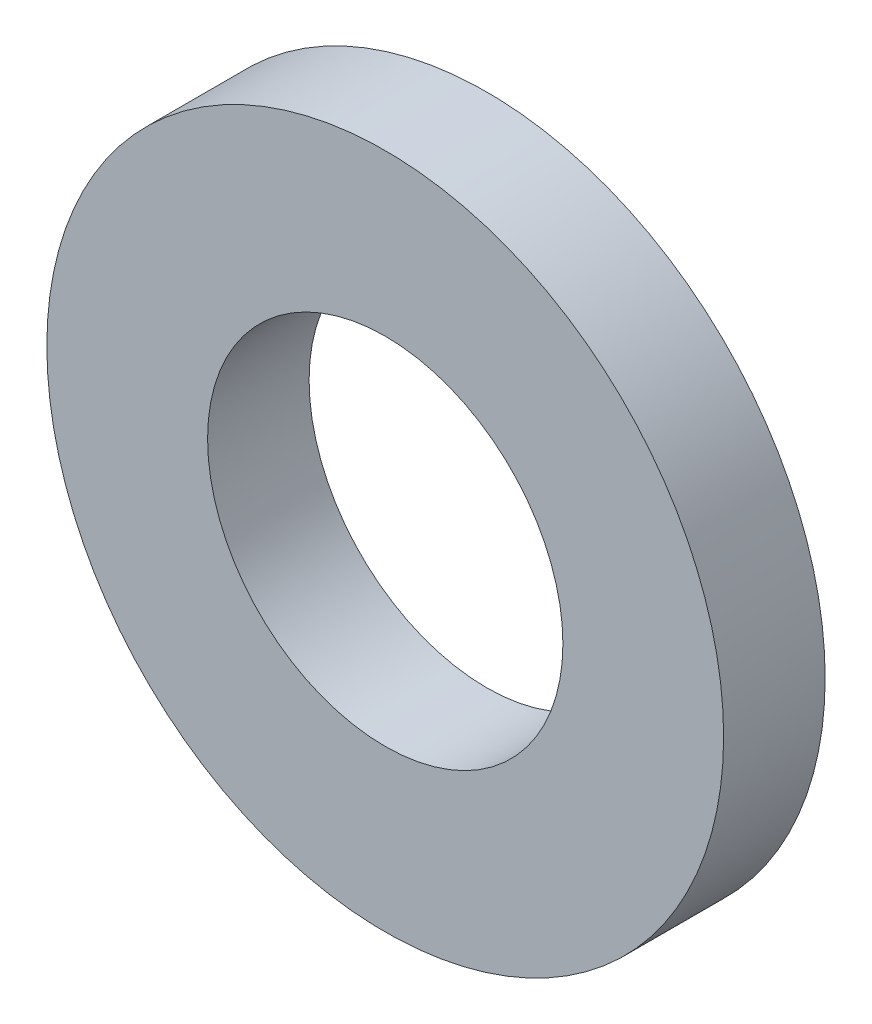
from build123d import *

# Parameters (mm, degrees)
SKETCH1_R           = 2
SKETCH1_R_2         = 1.05
BOSS_EXTRUDE1_DEPTH = 0.6


with BuildPart() as part:
    # Sketch1 → Boss-Extrude1 (new body)
    with BuildSketch(Plane.XY):
        Circle(SKETCH1_R)
        Circle(SKETCH1_R_2, mode=Mode.SUBTRACT)
    extrude(amount=BOSS_EXTRUDE1_DEPTH)


solid = part.part
